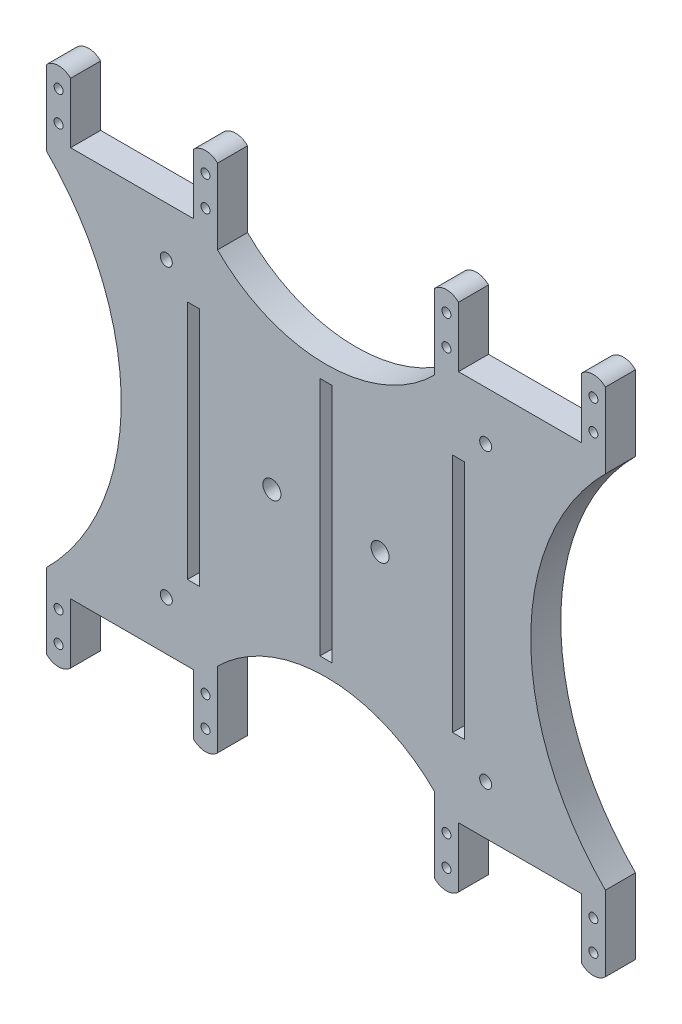
from build123d import *

# Parameters (mm, degrees)
SKETCH1_R               = 1.5
SKETCH1_W               = 4
SKETCH1_H               = 80
BOSS_EXTRUDE1_DEPTH     = 10
CUT_EXTRUDE1_DEPTH      = 128.50847183
CUT_EXTRUDE1_DEPTH_BACK = 20
SKETCH2_R               = 2
SKETCH3_R               = 3
CUT_EXTRUDE2_DEPTH      = 20


with BuildPart() as part:
    # Sketch1 → Boss-Extrude1 (new body)
    with BuildSketch(Plane.XY):
        with BuildLine():
            Line((-85, -85), (-85, -65))
            Line((-85, -65), (-44.1, -65))
            Line((-44.1, -65), (-44.1, -85))
            ThreePointArc((-44.1, -85), (-40.1, -86.656854249), (-36.1, -85))
            Line((-36.1, -85), (-36.1, -60))
            ThreePointArc((-36.1, -60), (0, -45.046890398), (36.1, -60))
            Line((36.1, -60), (36.1, -85))
            ThreePointArc((36.1, -85), (40.1, -86.656854249), (44.1, -85))
            Line((44.1, -85), (44.1, -65))
            Line((44.1, -65), (85, -65))
            Line((85, -65), (85, -85))
            ThreePointArc((85, -85), (89, -86.656854249), (93, -85))
            Line((93, -85), (93, -60))
            ThreePointArc((93, -60), (68.147186258, 0), (93, 60))
            Line((93, 60), (93, 85))
            ThreePointArc((93, 85), (89, 86.656854249), (85, 85))
            Line((85, 85), (85, 65))
            Line((85, 65), (44.1, 65))
            Line((44.1, 65), (44.1, 85))
            ThreePointArc((44.1, 85), (40.1, 86.656854249), (36.1, 85))
            Line((36.1, 85), (36.1, 60))
            ThreePointArc((36.1, 60), (0, 45.046890398), (-36.1, 60))
            Line((-36.1, 60), (-36.1, 85))
            ThreePointArc((-36.1, 85), (-40.1, 86.656854249), (-44.1, 85))
            Line((-44.1, 85), (-44.1, 65))
            Line((-44.1, 65), (-85, 65))
            Line((-85, 65), (-85, 85))
            ThreePointArc((-85, 85), (-89, 86.656854249), (-93, 85))
            Line((-93, 85), (-93, 60))
            ThreePointArc((-93, 60), (-68.147186258, 0), (-93, -60))
            Line((-93, -60), (-93, -85))
            ThreePointArc((-93, -85), (-89, -86.656854249), (-85, -85))
        make_face()
        with Locations((-89, 70)):
            Circle(SKETCH1_R, mode=Mode.SUBTRACT)
        with Locations((-89, 80)):
            Circle(SKETCH1_R, mode=Mode.SUBTRACT)
        with Locations((-40.1, 70)):
            Circle(SKETCH1_R, mode=Mode.SUBTRACT)
        with Locations((-40.1, 80)):
            Circle(SKETCH1_R, mode=Mode.SUBTRACT)
        with Locations((-40.1, -70)):
            Circle(SKETCH1_R, mode=Mode.SUBTRACT)
        with Locations((-40.1, -80)):
            Circle(SKETCH1_R, mode=Mode.SUBTRACT)
        with Locations((-89, -80)):
            Circle(SKETCH1_R, mode=Mode.SUBTRACT)
        with Locations((-89, -70)):
            Circle(SKETCH1_R, mode=Mode.SUBTRACT)
        with Locations((89, 80)):
            Circle(SKETCH1_R, mode=Mode.SUBTRACT)
        with Locations((89, 70)):
            Circle(SKETCH1_R, mode=Mode.SUBTRACT)
        with Locations((40.1, 80)):
            Circle(SKETCH1_R, mode=Mode.SUBTRACT)
        with Locations((40.1, 70)):
            Circle(SKETCH1_R, mode=Mode.SUBTRACT)
        with Locations((89, -70)):
            Circle(SKETCH1_R, mode=Mode.SUBTRACT)
        with Locations((89, -80)):
            Circle(SKETCH1_R, mode=Mode.SUBTRACT)
        with Locations((40.1, -80)):
            Circle(SKETCH1_R, mode=Mode.SUBTRACT)
        with Locations((40.1, -70)):
            Circle(SKETCH1_R, mode=Mode.SUBTRACT)
        with Locations((44.1, 0)):
            Rectangle(SKETCH1_W, SKETCH1_H, mode=Mode.SUBTRACT)
        with Locations((-44.1, 0)):
            Rectangle(SKETCH1_W, SKETCH1_H, mode=Mode.SUBTRACT)
        Rectangle(SKETCH1_W, SKETCH1_H, mode=Mode.SUBTRACT)
    extrude(amount=BOSS_EXTRUDE1_DEPTH)

    # Sketch2 → Cut-Extrude1 (cut, two sides: drawn at the far end of the back side and taken through both)
    with BuildSketch(Plane.XY.offset(10).offset(-CUT_EXTRUDE1_DEPTH_BACK)):
        with Locations(Location((53.15, -48.68, 0), (0, 0, 180))):
            Circle(SKETCH2_R)
        with Locations(Location((-53.15, -48.68, 0), (0, 0, 180))):
            Circle(SKETCH2_R)
        with Locations(Location((53.15, 48.68, 0), (0, 0, 180))):
            Circle(SKETCH2_R)
        with Locations(Location((-53.15, 48.68, 0), (0, 0, 180))):
            Circle(SKETCH2_R)
    extrude(amount=CUT_EXTRUDE1_DEPTH + CUT_EXTRUDE1_DEPTH_BACK, mode=Mode.SUBTRACT)

    # Sketch3 → Cut-Extrude2 (cut)
    with BuildSketch(Plane.XY.offset(10)):
        with Locations((18, 0)):
            Circle(SKETCH3_R)
        with Locations((-18, 0)):
            Circle(SKETCH3_R)
    extrude(amount=-CUT_EXTRUDE2_DEPTH, mode=Mode.SUBTRACT)


solid = part.part
